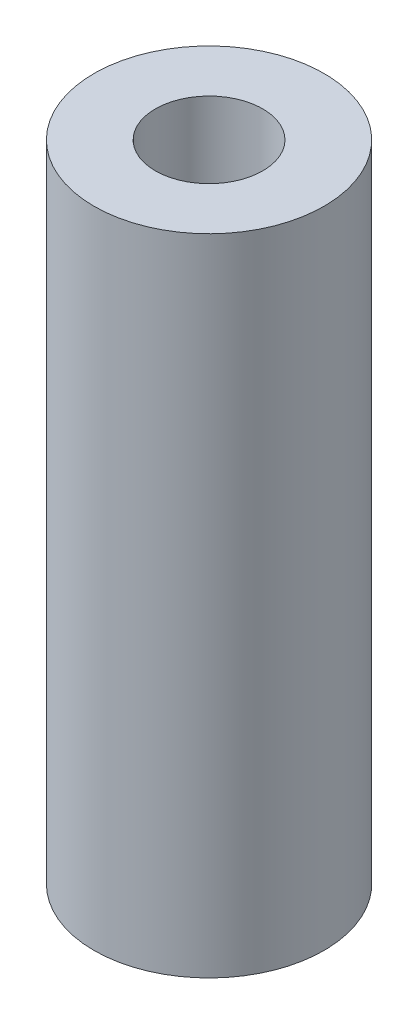
from build123d import *

# Parameters (mm, degrees)
SKETCH1_R           = 3.2639
SKETCH1_R_2         = 1.524
BOSS_EXTRUDE1_DEPTH = 18.288


with BuildPart() as part:
    # Sketch1 → Boss-Extrude1 (new body)
    with BuildSketch(Plane(origin=(0, 0, 0), x_dir=(1, 0, 0), z_dir=(0, 1, 0))):
        with Locations(Location((0, 0, 0), (0, 0, 270))):
            Circle(SKETCH1_R)
        with Locations(Location((0, 0, 0), (0, 0, 270))):
            Circle(SKETCH1_R_2, mode=Mode.SUBTRACT)
    extrude(amount=BOSS_EXTRUDE1_DEPTH)


solid = part.part
